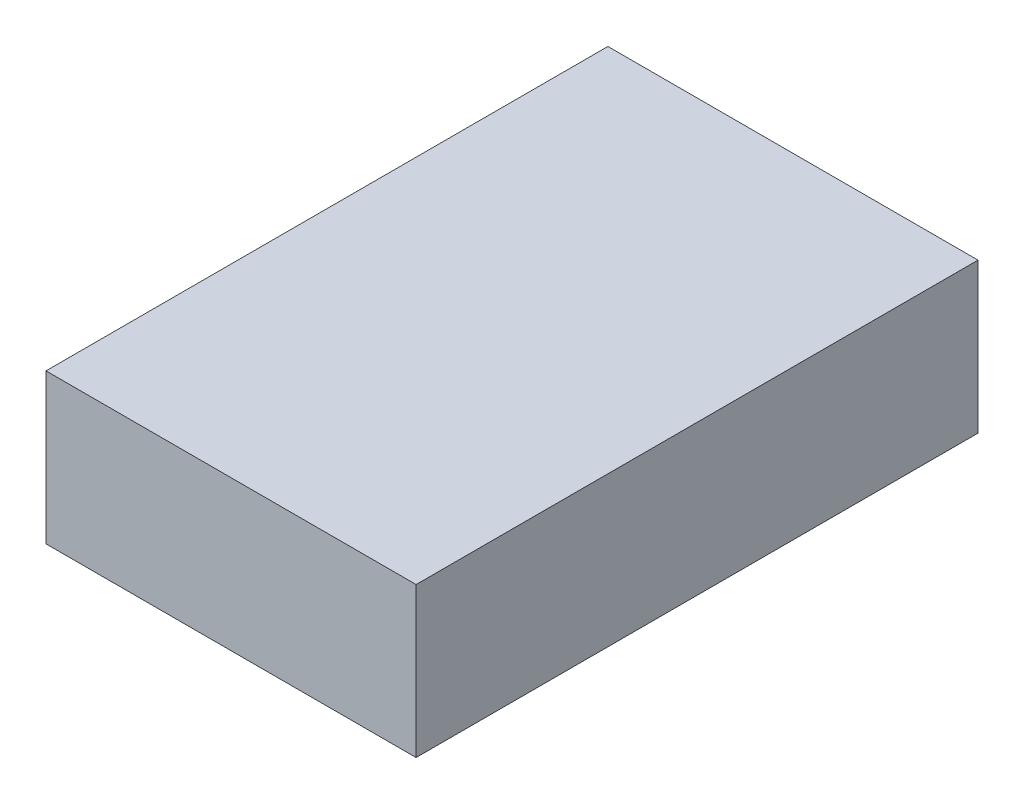
from build123d import *

# Parameters (mm, degrees)
SKETCH1_W           = 9.88
SKETCH1_H           = 15
BOSS_EXTRUDE1_DEPTH = 2


with BuildPart() as part:
    # Sketch1 → Boss-Extrude1 (new, symmetric)
    with BuildSketch(Plane(origin=(0, 0, 0), x_dir=(1, 0, 0), z_dir=(0, 1, 0))):
        with Locations((4.94, 7.5)):
            Rectangle(SKETCH1_W, SKETCH1_H)
    extrude(amount=BOSS_EXTRUDE1_DEPTH, both=True)


solid = part.part
